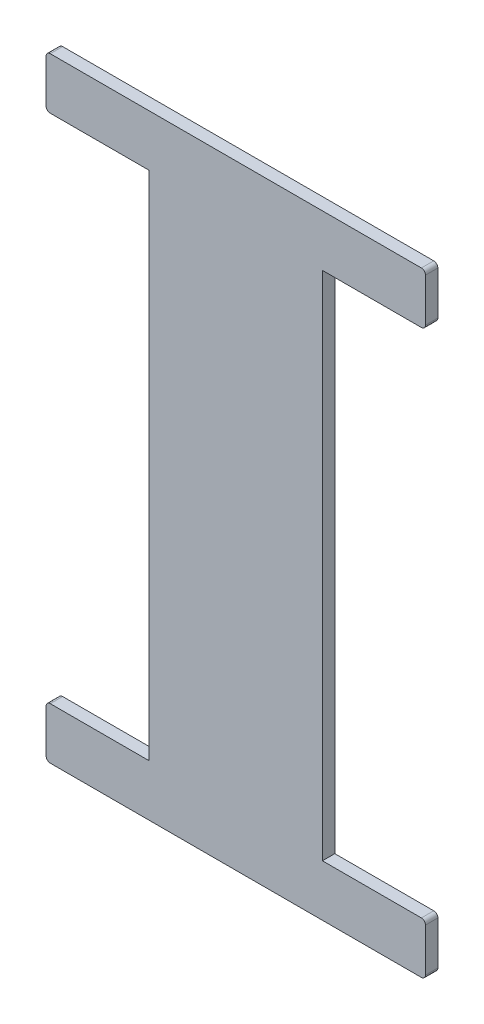
from build123d import *

# Parameters (mm, degrees)
SKETCH_1_W      = 42
SKETCH_1_H      = 149
EXTRUDE_1_DEPTH = 3
SKETCH_2_W      = 25
SKETCH_2_H      = 12.5
EXTRUDE_2_DEPTH = 3
FILLET_1_R      = 1


with BuildPart() as part:
    # 草图1 → 凸台-拉伸1 (new body)
    with BuildSketch(Plane.XY):
        Rectangle(SKETCH_1_W, SKETCH_1_H)
    extrude(amount=EXTRUDE_1_DEPTH)

    # 草图2 → 凸台-拉伸2 (add)
    with BuildSketch(Plane.XY.offset(3)):
        with Locations((33.5, -68.25)):
            Rectangle(SKETCH_2_W, SKETCH_2_H)
        with Locations((-33.5, -68.25)):
            Rectangle(SKETCH_2_W, SKETCH_2_H)
        with Locations((-33.5, 68.25)):
            Rectangle(SKETCH_2_W, SKETCH_2_H)
        with Locations((33.5, 68.25)):
            Rectangle(SKETCH_2_W, SKETCH_2_H)
    extrude(amount=-EXTRUDE_2_DEPTH)

    # 圆角1
    fillet_1_edges = [part.edges().sort_by_distance(p)[0] for p in [
        (46, -74.5, 1.5),
        (46, -62, 1.5),
        (-46, -62, 1.5),
        (-46, -74.5, 1.5),
        (-46, 74.5, 1.5),
        (-46, 62, 1.5),
        (46, 62, 1.5),
        (46, 74.5, 1.5),
    ]]
    fillet(fillet_1_edges, radius=FILLET_1_R)


solid = part.part
